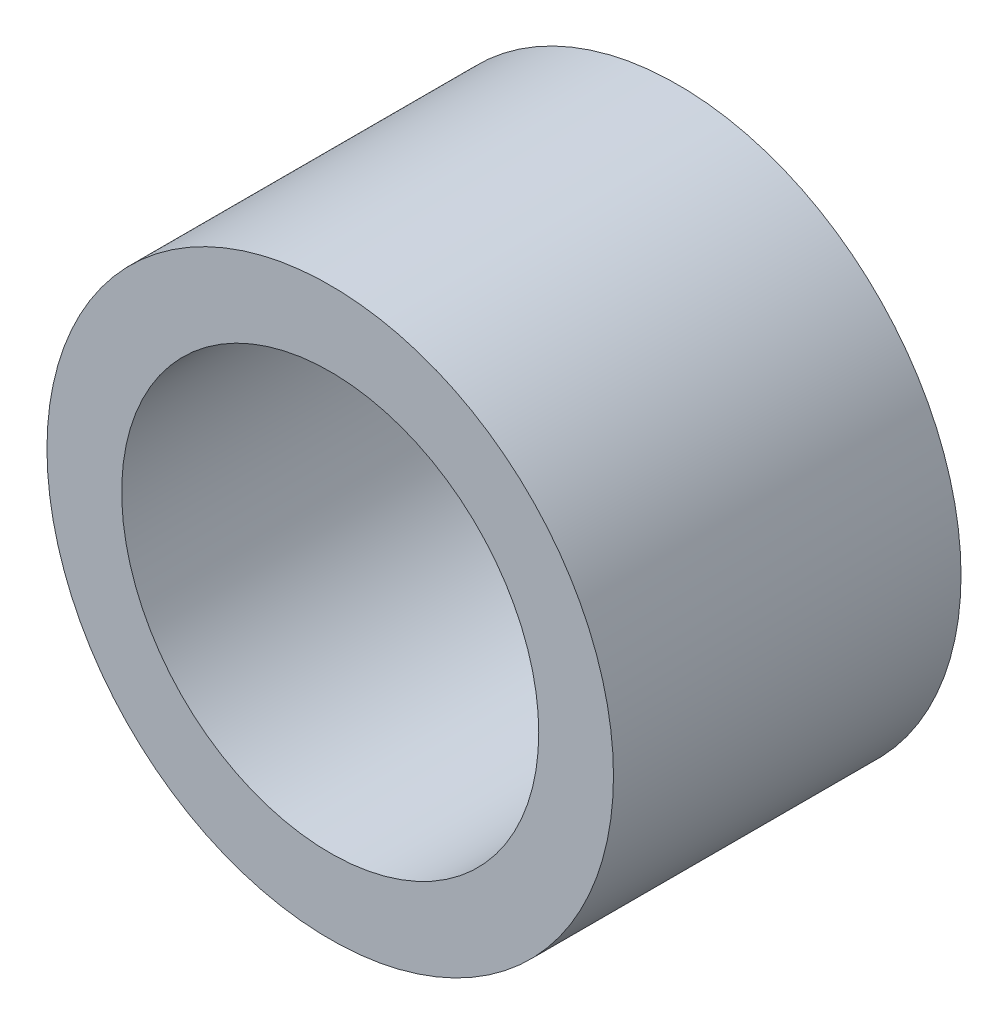
from build123d import *

# Parameters (mm, degrees)
SKETCH1_R           = 4.075
SKETCH1_R_2         = 3
BOSS_EXTRUDE1_DEPTH = 5


with BuildPart() as part:
    # Sketch1 → Boss-Extrude1 (new body)
    with BuildSketch(Plane.XY):
        Circle(SKETCH1_R)
        Circle(SKETCH1_R_2, mode=Mode.SUBTRACT)
    extrude(amount=BOSS_EXTRUDE1_DEPTH)


solid = part.part
